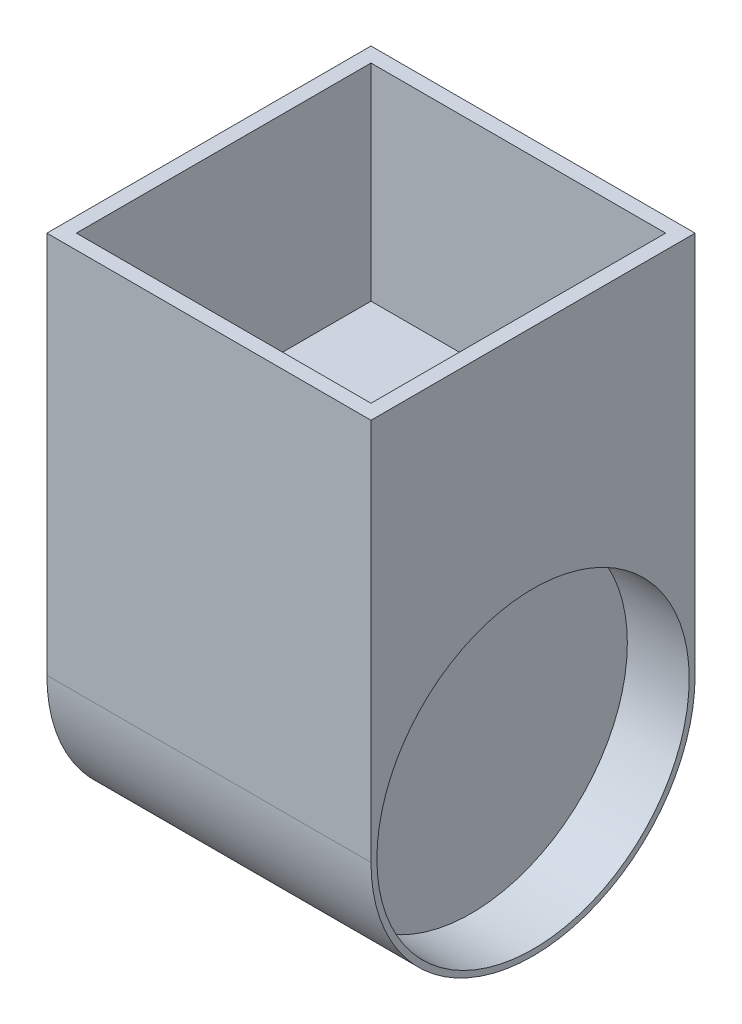
from build123d import *

# Parameters (mm, degrees)
BOSS_EXTRUDE1_DEPTH = 110
SKETCH2_W           = 100
SKETCH2_H           = 100
CUT_EXTRUDE1_DEPTH  = 70
SKETCH3_R           = 53
CUT_EXTRUDE2_DEPTH  = 21


with BuildPart() as part:
    # Sketch1 → Boss-Extrude1 (new body)
    with BuildSketch(Plane(origin=(0, 0, 0), x_dir=(0, 0, -1), z_dir=(1, 0, 0))):
        with BuildLine():
            Line((55, 129.977668722), (55, -2.75e-07))
            ThreePointArc((55, -2.75e-07), (-2.948e-06, -55), (-55, 5.622e-06))
            Line((-55, 5.622e-06), (-55, 129.977668722))
            Line((-55, 129.977668722), (55, 129.977668722))
        make_face()
    extrude(amount=BOSS_EXTRUDE1_DEPTH)

    # Sketch2 → Cut-Extrude1 (cut)
    with BuildSketch(Plane(origin=(0, 129.977668722, 0), x_dir=(1, 0, 0), z_dir=(0, 1, 0))):
        with Locations((55, 0)):
            Rectangle(SKETCH2_W, SKETCH2_H)
    extrude(amount=-CUT_EXTRUDE1_DEPTH, mode=Mode.SUBTRACT)

    # Sketch3 → Cut-Extrude2 (cut)
    with BuildSketch(Plane(origin=(110, 0, 0), x_dir=(0, 0, -1), z_dir=(1, 0, 0))):
        Circle(SKETCH3_R)
    extrude(amount=-CUT_EXTRUDE2_DEPTH, mode=Mode.SUBTRACT)


solid = part.part
